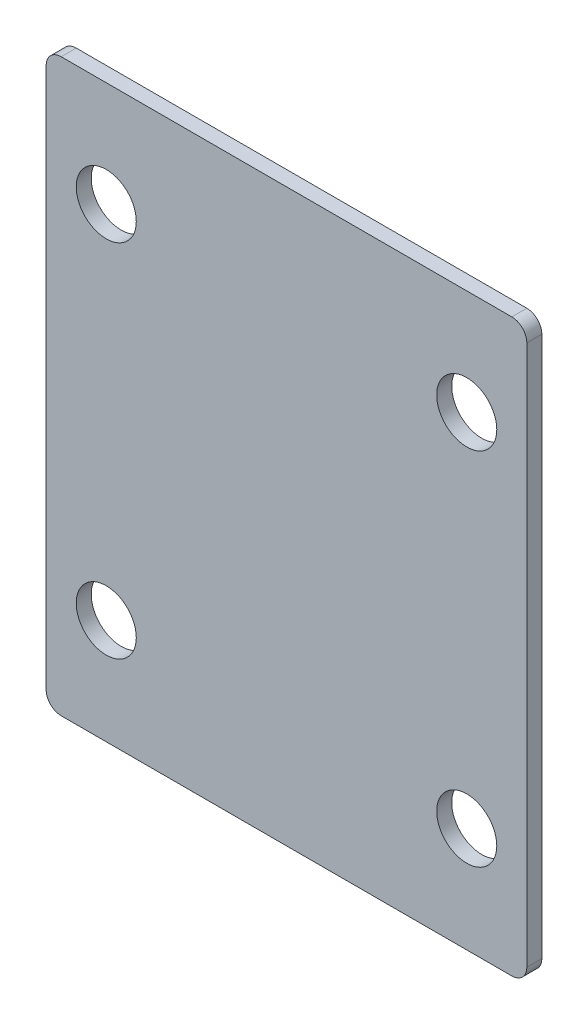
from build123d import *

# Parameters (mm, degrees)
SKETCH2_R           = 1
BOSS_EXTRUDE1_DEPTH = 0.5


with BuildPart() as part:
    # Sketch2 → Boss-Extrude1 (new body)
    with BuildSketch(Plane.XY):
        with BuildLine():
            Line((7.5, 9.5), (-7.5, 9.5))
            ThreePointArc((-7.5, 9.5), (-7.853553391, 9.353553391), (-8, 9))
            Line((-8, 9), (-8, -9))
            ThreePointArc((-8, -9), (-7.853553391, -9.353553391), (-7.5, -9.5))
            Line((-7.5, -9.5), (7.5, -9.5))
            ThreePointArc((7.5, -9.5), (7.853553391, -9.353553391), (8, -9))
            Line((8, -9), (8, 9))
            ThreePointArc((8, 9), (7.853553391, 9.353553391), (7.5, 9.5))
        make_face()
        with Locations((-6, -6)):
            Circle(SKETCH2_R, mode=Mode.SUBTRACT)
        with Locations((6, -6)):
            Circle(SKETCH2_R, mode=Mode.SUBTRACT)
        with Locations((6, 6)):
            Circle(SKETCH2_R, mode=Mode.SUBTRACT)
        with Locations((-6, 6)):
            Circle(SKETCH2_R, mode=Mode.SUBTRACT)
    extrude(amount=BOSS_EXTRUDE1_DEPTH)


solid = part.part
